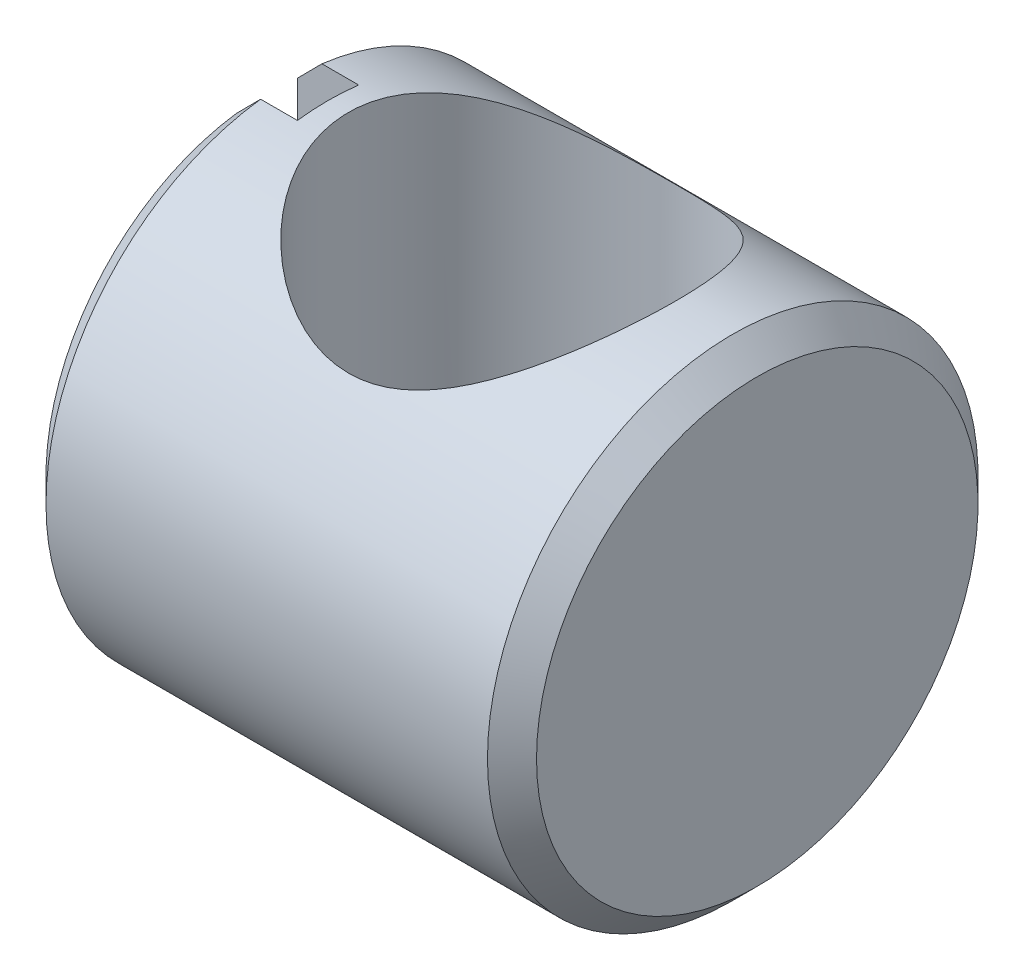
from build123d import *

# Parameters (mm, degrees)
SKETCH1_R               = 6
BOSS_EXTRUDE1_DEPTH     = 6
CHAMFER1_SIZE           = 0.6
CUT_EXTRUDE1_DEPTH      = 11.392304845
CUT_EXTRUDE1_DEPTH_BACK = 11.392304845
SKETCH2_R               = 4
SKETCH3_W               = 1.5
SKETCH3_H               = 13.826589008
CUT_EXTRUDE2_DEPTH      = 1.5


with BuildPart() as part:
    # Sketch1 → Boss-Extrude1 (new, symmetric)
    with BuildSketch(Plane(origin=(0, 0, 0), x_dir=(0, 0, -1), z_dir=(1, 0, 0))):
        Circle(SKETCH1_R)
    extrude(amount=BOSS_EXTRUDE1_DEPTH, both=True)

    # Chamfer1
    chamfer1_edges = [part.edges().sort_by_distance(p)[0] for p in [
        (-6, 0, 6),
        (6, 0, 6),
    ]]
    chamfer(chamfer1_edges, length=CHAMFER1_SIZE)

    # Sketch2 → Cut-Extrude1 (cut, two sides: drawn at the far end of the back side and taken through both)
    with BuildSketch(Plane(origin=(0, 0, 0), x_dir=(1, 0, 0), z_dir=(0, 1, 0)).offset(-CUT_EXTRUDE1_DEPTH_BACK)):
        with Locations(Location((0, 0, 0), (0, 0, 270))):
            Circle(SKETCH2_R)
    extrude(amount=CUT_EXTRUDE1_DEPTH + CUT_EXTRUDE1_DEPTH_BACK, mode=Mode.SUBTRACT)

    # Sketch3 → Cut-Extrude2 (cut)
    with BuildSketch(Plane.ZY.offset(6)):
        Rectangle(SKETCH3_W, SKETCH3_H)
    extrude(amount=-CUT_EXTRUDE2_DEPTH, mode=Mode.SUBTRACT)


solid = part.part
